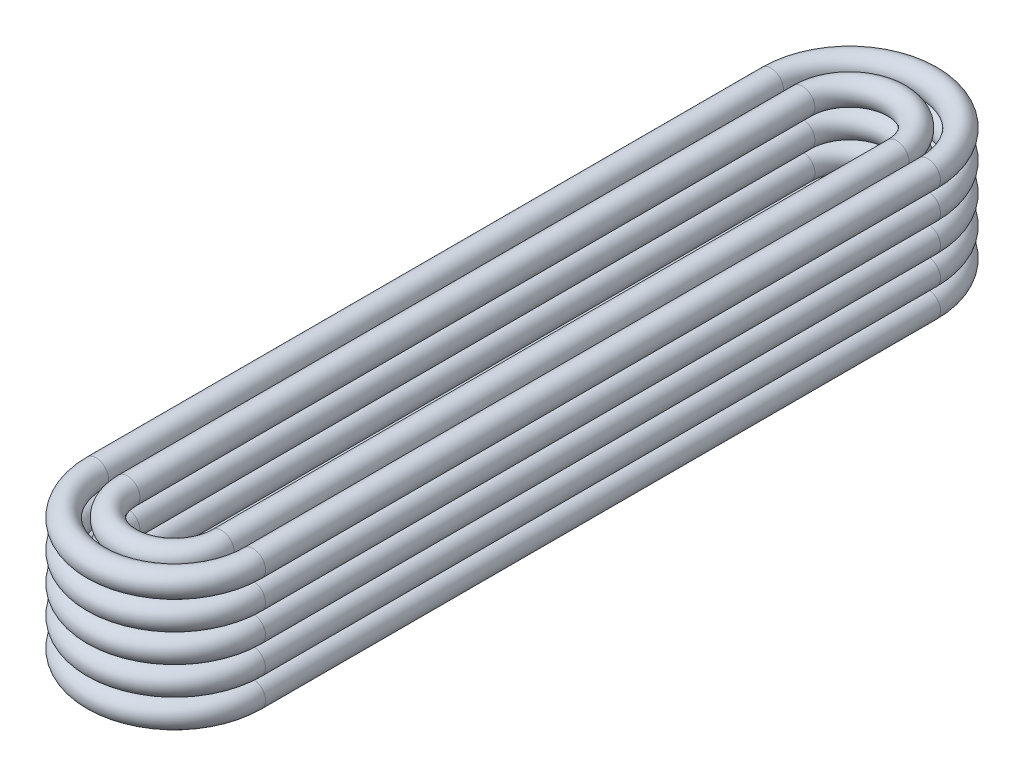
from build123d import *

# Parameters (mm, degrees)
ESQUISSE2_R                = 0.8
ESQUISSE4_R                = 0.8
R_P_TITION_LIN_AIRE1_COUNT = 5
R_P_TITION_LIN_AIRE1_PITCH = 1.8


with BuildPart() as part:
    # Balayage1: sweep along a path in Esquisse1
    with BuildLine(Plane(origin=(0, 0, 0), x_dir=(1, 0, 0), z_dir=(0, 1, 0))) as balayage1_path:
        Line((-3, -21.5), (-3, 21.5))
        ThreePointArc((-3, 21.5), (0, 24.5), (3, 21.5))
        Line((3, 21.5), (3, -21.5))
        ThreePointArc((3, -21.5), (0, -24.5), (-3, -21.5))
    # Esquisse2 → Balayage1 (sweep)
    with BuildSketch(Plane.XY):
        with Locations((-3, 0)):
            Circle(ESQUISSE2_R)
    sweep(path=balayage1_path.line)


with BuildPart() as body_2:
    # Balayage2: sweep along a path in Esquisse3
    with BuildLine(Plane(origin=(0, 0, 0), x_dir=(1, 0, 0), z_dir=(0, 1, 0))) as balayage2_path:
        Line((-5, 21.5), (-5, -21.5))
        ThreePointArc((-5, -21.5), (0, -26.5), (5, -21.5))
        Line((5, -21.5), (5, 21.5))
        ThreePointArc((5, 21.5), (0, 26.5), (-5, 21.5))
    # Esquisse4 → Balayage2 (sweep)
    with BuildSketch(Plane.XY):
        with Locations((-5, 0)):
            Circle(ESQUISSE4_R)
    sweep(path=balayage2_path.line)


with BuildPart() as r_p_tition_lin_aire1_1:
    # Répétition linéaire1: pattern copy
    add(part.part.moved(Location(Vector(0, 1, 0) * (1 * R_P_TITION_LIN_AIRE1_PITCH))))


with BuildPart() as r_p_tition_lin_aire1_2:
    # Répétition linéaire1: pattern copy
    add(part.part.moved(Location(Vector(0, 1, 0) * (2 * R_P_TITION_LIN_AIRE1_PITCH))))


with BuildPart() as r_p_tition_lin_aire1_3:
    # Répétition linéaire1: pattern copy
    add(part.part.moved(Location(Vector(0, 1, 0) * (3 * R_P_TITION_LIN_AIRE1_PITCH))))


with BuildPart() as r_p_tition_lin_aire1_4:
    # Répétition linéaire1: pattern copy
    add(part.part.moved(Location(Vector(0, 1, 0) * (4 * R_P_TITION_LIN_AIRE1_PITCH))))


with BuildPart() as r_p_tition_lin_aire1_5:
    # Répétition linéaire1: pattern copy
    add(body_2.part.moved(Location(Vector(0, 1, 0) * (1 * R_P_TITION_LIN_AIRE1_PITCH))))


with BuildPart() as r_p_tition_lin_aire1_6:
    # Répétition linéaire1: pattern copy
    add(body_2.part.moved(Location(Vector(0, 1, 0) * (2 * R_P_TITION_LIN_AIRE1_PITCH))))


with BuildPart() as r_p_tition_lin_aire1_7:
    # Répétition linéaire1: pattern copy
    add(body_2.part.moved(Location(Vector(0, 1, 0) * (3 * R_P_TITION_LIN_AIRE1_PITCH))))


with BuildPart() as r_p_tition_lin_aire1_8:
    # Répétition linéaire1: pattern copy
    add(body_2.part.moved(Location(Vector(0, 1, 0) * (4 * R_P_TITION_LIN_AIRE1_PITCH))))


solid = Compound([part.part, body_2.part, r_p_tition_lin_aire1_1.part, r_p_tition_lin_aire1_2.part, r_p_tition_lin_aire1_3.part, r_p_tition_lin_aire1_4.part, r_p_tition_lin_aire1_5.part, r_p_tition_lin_aire1_6.part, r_p_tition_lin_aire1_7.part, r_p_tition_lin_aire1_8.part])
